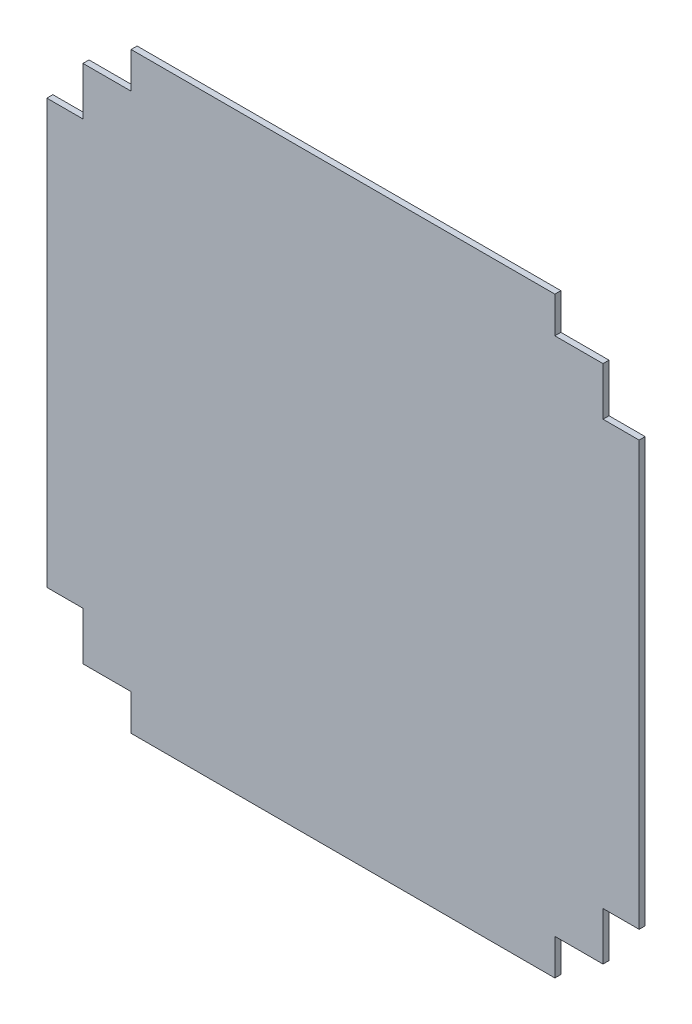
from build123d import *

# Parameters (mm, degrees)
SALIENTE_EXTRUIR1_DEPTH = 5


with BuildPart() as part:
    # Croquis1 → Saliente-Extruir1 (new body)
    with BuildSketch(Plane.XY):
        Polygon((0, 246), (0, 0), (246, 0), (246, 176), (216, 176), (216, 216), (176, 216), (176, 246), align=None)
        Polygon((-246, 176), (-246, 0), (0, 0), (0, 246), (-176, 246), (-176, 216), (-216, 216), (-216, 176), align=None)
        Polygon((0, 0), (-246, 0), (-246, -176), (-216, -176), (-216, -216), (-176, -216), (-176, -246), (176, -246), (176, -216), (216, -216), (216, -176), (246, -176), (246, 0), align=None)
    extrude(amount=SALIENTE_EXTRUIR1_DEPTH)


solid = part.part
